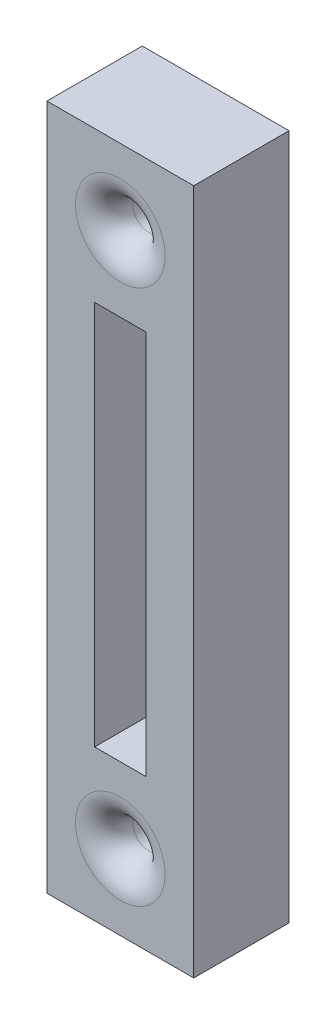
from build123d import *

# Parameters (mm, degrees)
SKETCH1_W           = 15.4
SKETCH1_H           = 50.4
SKETCH1_W_2         = 5.4
SKETCH1_H_2         = 40.4
EXTRUDE_THIN1_DEPTH = 10
SKETCH2_W           = 15.4
SKETCH2_H           = 10
BOSS_EXTRUDE1_DEPTH = 10.8
SKETCH3_R           = 1.7
CUT_EXTRUDE1_DEPTH  = 59.022409464
FILLET1_R           = 3


with BuildPart() as part:
    # Sketch1 → Extrude-Thin1 (new body)
    with BuildSketch(Plane.XY):
        with Locations((2.7, 20.2)):
            Rectangle(SKETCH1_W, SKETCH1_H)
        with Locations((2.7, 20.2)):
            Rectangle(SKETCH1_W_2, SKETCH1_H_2, mode=Mode.SUBTRACT)
    extrude(amount=EXTRUDE_THIN1_DEPTH)

    # Sketch2 → Boss-Extrude1 (add)
    with BuildSketch(Plane(origin=(0, 45.4, 0), x_dir=(1, 0, 0), z_dir=(0, 1, 0))):
        with Locations((2.7, -5)):
            Rectangle(SKETCH2_W, SKETCH2_H)
    boss_extrude1 = extrude(amount=BOSS_EXTRUDE1_DEPTH)

    # Mirror1: Boss-Extrude1 across plane
    add(boss_extrude1.mirror(Plane.ZX.offset(20.2)))

    # Sketch3 → Cut-Extrude1 (cut, through all)
    with BuildSketch(Plane(origin=(0, 0, 0), x_dir=(-1, 0, 0), z_dir=(0, 0, -1))):
        with Locations((-2.7, 48.3)):
            Circle(SKETCH3_R)
    cut_extrude1 = extrude(amount=-CUT_EXTRUDE1_DEPTH, mode=Mode.SUBTRACT)

    # Mirror2: Cut-Extrude1 across plane
    add(cut_extrude1.mirror(Plane.ZX.offset(20.2)), mode=Mode.SUBTRACT)

    # Fillet1
    fillet1_edges = [part.edges().sort_by_distance(p)[0] for p in [
        (4.4, 48.3, 10),
        (4.4, 48.3, 0),
        (4.4, -7.9, 0),
        (4.4, -7.9, 10),
    ]]
    fillet(fillet1_edges, radius=FILLET1_R)


solid = part.part
